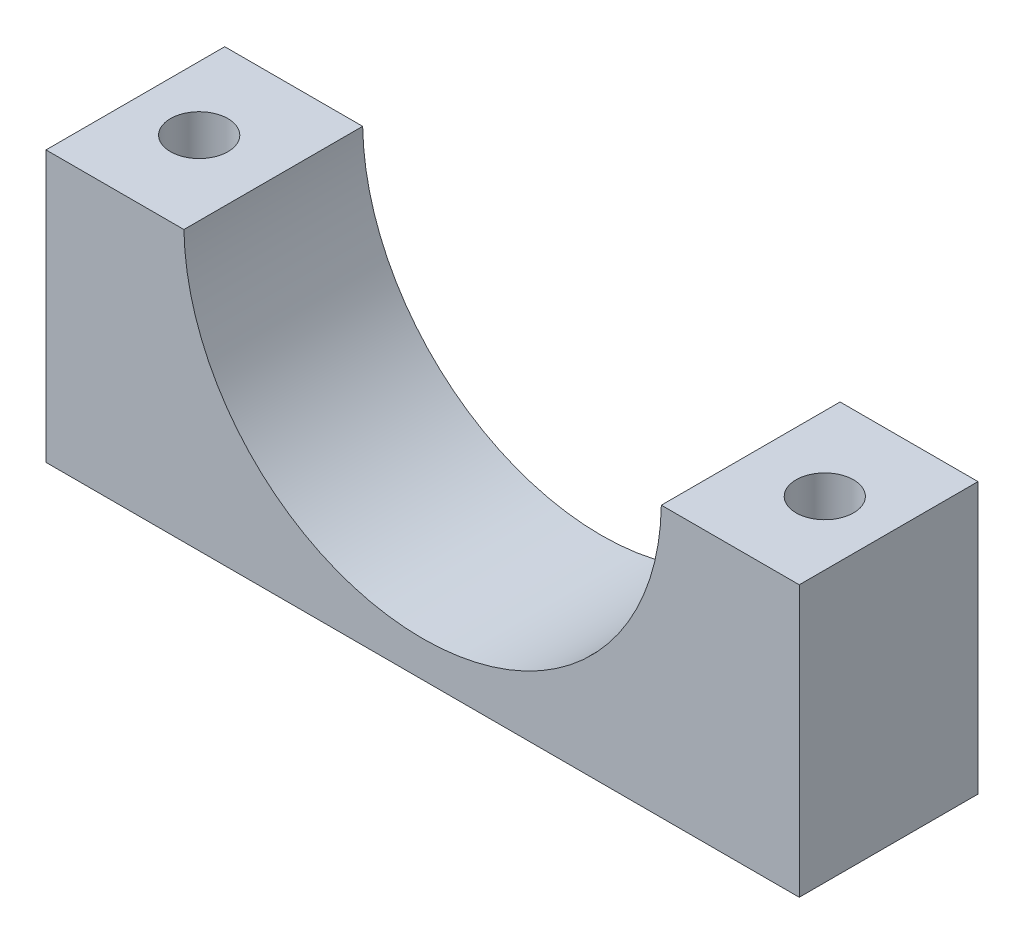
from build123d import *

# Parameters (mm, degrees)
SPLIT_SADDLE_WITH_37_4_MM_BORE_DEPTH = 14
M4_THROUGH_HOLES_DEPTH               = 44.144988121
M4_THROUGH_HOLES_DEPTH_BACK          = 44.144988121
SKETCH2_R                            = 2.25


with BuildPart() as part:
    # Split saddle with 37.4 mm bore profile → Split saddle with 37.4 mm bore (new body)
    with BuildSketch(Plane.XY):
        with BuildLine():
            Line((-29.5, 7), (29.5, 7))
            Line((29.5, 7), (29.5, 28.2))
            Line((29.5, 28.2), (18.697593428, 28.2))
            ThreePointArc((18.697593428, 28.2), (0, 9.8), (-18.697593428, 28.2))
            Line((-18.697593428, 28.2), (-29.5, 28.2))
            Line((-29.5, 28.2), (-29.5, 7))
        make_face()
    extrude(amount=SPLIT_SADDLE_WITH_37_4_MM_BORE_DEPTH)

    # Sketch2 → M4 through holes (cut, two sides: drawn at the far end of the back side and taken through both)
    with BuildSketch(Plane(origin=(0, 0, 0), x_dir=(1, 0, 0), z_dir=(0, 1, 0)).offset(-M4_THROUGH_HOLES_DEPTH_BACK)):
        with Locations(Location((-24.5, -7, 0), (0, 0, 270))):
            Circle(SKETCH2_R)
        with Locations(Location((24.5, -7, 0), (0, 0, 270))):
            Circle(SKETCH2_R)
    extrude(amount=M4_THROUGH_HOLES_DEPTH + M4_THROUGH_HOLES_DEPTH_BACK, mode=Mode.SUBTRACT)


solid = part.part
